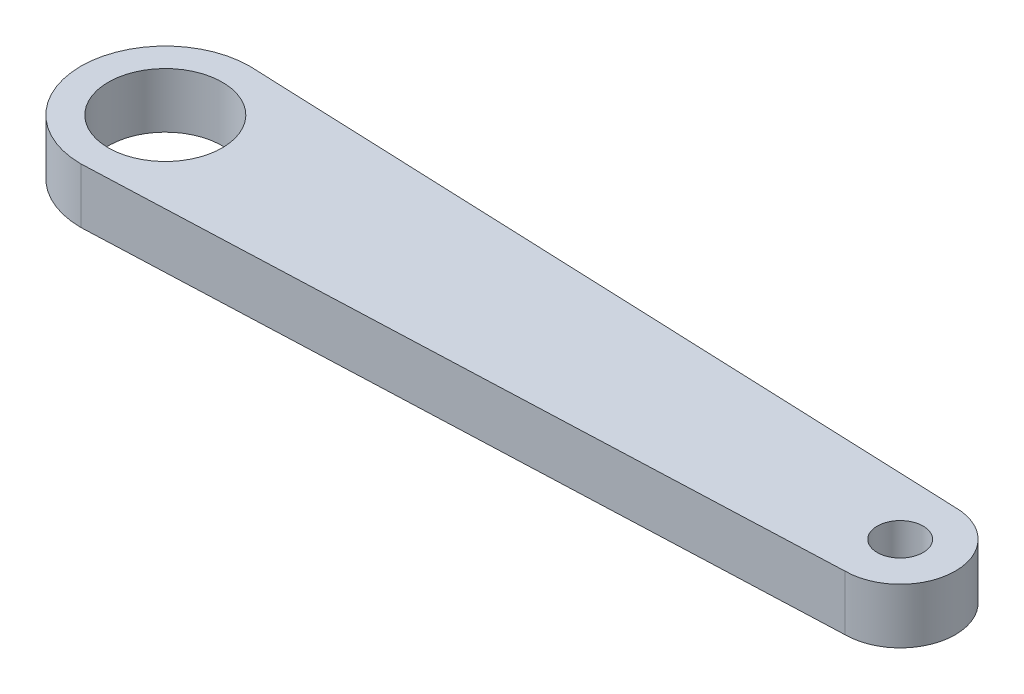
from build123d import *

# Parameters (mm, degrees)
SKETCH1_R           = 3.1
SKETCH1_R_2         = 3
SKETCH1_R_3         = 1.25
BOSS_EXTRUDE1_DEPTH = 3


with BuildPart() as part:
    # Sketch1 → Boss-Extrude1 (new body)
    # profile 1 of 3: a face of its own
    with BuildSketch(Plane(origin=(0, 0, 0), x_dir=(1, 0, 0), z_dir=(0, 1, 0))):
        with BuildLine():
            Line((40, 3), (0.367412141, 4.585303514))
            ThreePointArc((0.367412141, 4.585303514), (3.380095845, 3.120088473), (4.6, 0))
            ThreePointArc((4.6, 0), (3.380095845, -3.120088473), (0.367412141, -4.585303514))
            Line((0.367412141, -4.585303514), (40, -3))
            ThreePointArc((40, -3), (37, 0), (40, 3))
        make_face()
    # profile 2 of 3: a face of its own
    with BuildSketch(Plane(origin=(0, 0, 0), x_dir=(1, 0, 0), z_dir=(0, 1, 0))):
        with BuildLine():
            Line((0.367412141, 4.585303514), (0, 4.6))
            ThreePointArc((0, 4.6), (-4.6, 0), (0, -4.6))
            Line((0, -4.6), (0.367412141, -4.585303514))
            ThreePointArc((0.367412141, -4.585303514), (3.380095845, -3.120088473), (4.6, 0))
            ThreePointArc((4.6, 0), (3.380095845, 3.120088473), (0.367412141, 4.585303514))
        make_face()
        with Locations(Location((0, 0, 0), (0, 0, 270))):
            Circle(SKETCH1_R, mode=Mode.SUBTRACT)
    # profile 3 of 3: a face of its own
    with BuildSketch(Plane(origin=(0, 0, 0), x_dir=(1, 0, 0), z_dir=(0, 1, 0))):
        with Locations((40, 0)):
            Circle(SKETCH1_R_2)
        with Locations(Location((40, 0, 0), (0, 0, 270))):
            Circle(SKETCH1_R_3, mode=Mode.SUBTRACT)
    extrude(amount=BOSS_EXTRUDE1_DEPTH)


solid = part.part
